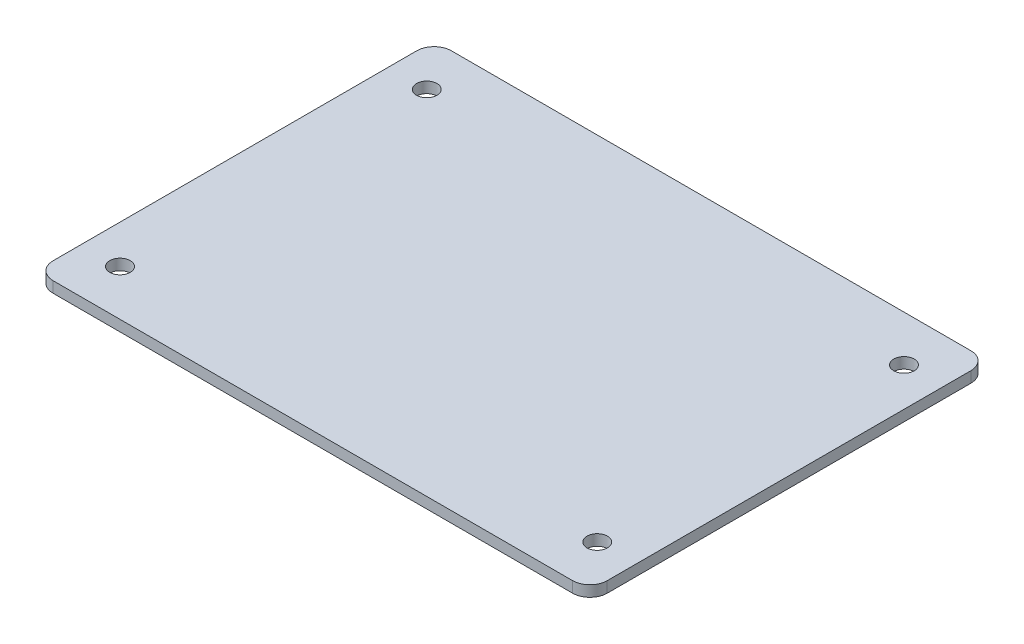
from build123d import *

# Parameters (mm, degrees)
SKETCH_1_R      = 1.5
EXTRUDE_1_DEPTH = 1.6


with BuildPart() as part:
    # Эскиз1 → Бобышка-Вытянуть1 (new body)
    with BuildSketch(Plane(origin=(0, 0, 0), x_dir=(1, 0, 0), z_dir=(0, 1, 0))):
        with BuildLine():
            Line((38.1, -29.21), (-38.1, -29.21))
            ThreePointArc((-38.1, -29.21), (-39.896051224, -28.466051224), (-40.64, -26.67))
            Line((-40.64, -26.67), (-40.64, 26.67))
            ThreePointArc((-40.64, 26.67), (-39.896051224, 28.466051224), (-38.1, 29.21))
            Line((-38.1, 29.21), (38.1, 29.21))
            ThreePointArc((38.1, 29.21), (39.896051224, 28.466051224), (40.64, 26.67))
            Line((40.64, 26.67), (40.64, -26.67))
            ThreePointArc((40.64, -26.67), (39.896051224, -28.466051224), (38.1, -29.21))
        make_face()
        with Locations(Location((-35, 22.5, 0), (0, 0, 270))):
            Circle(SKETCH_1_R, mode=Mode.SUBTRACT)
        with Locations(Location((35, 22.5, 0), (0, 0, 270))):
            Circle(SKETCH_1_R, mode=Mode.SUBTRACT)
        with Locations(Location((35, -22.5, 0), (0, 0, 270))):
            Circle(SKETCH_1_R, mode=Mode.SUBTRACT)
        with Locations(Location((-35, -22.5, 0), (0, 0, 270))):
            Circle(SKETCH_1_R, mode=Mode.SUBTRACT)
    extrude(amount=EXTRUDE_1_DEPTH)


solid = part.part
